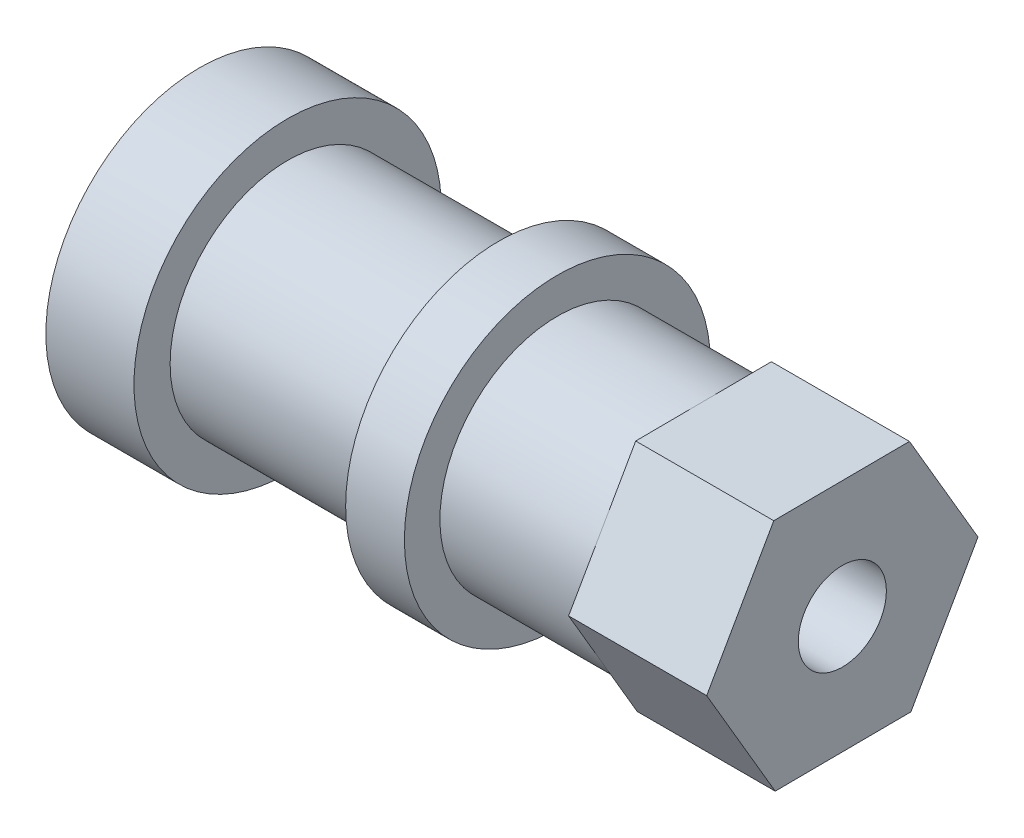
from build123d import *

# Parameters (mm, degrees)
BOSS_EXTRUDE1_DEPTH     = 4.7
SKETCH3_R               = 4
SKETCH3_R_2             = 1.5
BOSS_EXTRUDE2_DEPTH     = 17.185
SKETCH4_R               = 5.231012233
BOSS_EXTRUDE3_DEPTH     = 3
CUT_EXTRUDE1_DEPTH      = 24.101519495
CUT_EXTRUDE1_DEPTH_BACK = 24.101519495
SKETCH2_R               = 1.5
CUT_EXTRUDE4_DEPTH      = 2
BOSS_EXTRUDE5_START     = -7
SKETCH7_R               = 5.209530261
SKETCH7_R_2             = 1.5
BOSS_EXTRUDE5_DEPTH     = 2


with BuildPart() as part:
    # Sketch1 → Boss-Extrude1 (new body)
    with BuildSketch(Plane(origin=(0, 0, 0), x_dir=(0, 0, -1), z_dir=(1, 0, 0))):
        Polygon((-4.618711934, -0.028868683), (-2.284354955, -4.014356209), (2.33435698, -3.985487527), (4.618711934, 0.028868683), (2.284354955, 4.014356209), (-2.33435698, 3.985487527), align=None)
    extrude(amount=BOSS_EXTRUDE1_DEPTH)

    # Sketch3 → Boss-Extrude2 (add)
    with BuildSketch(Plane.ZY):
        with Locations(Location((0, 0, 0), (0, 0, 209.641884541))):
            Circle(SKETCH3_R)
        with Locations(Location((0, 0, 0), (0, 0, 180))):
            Circle(SKETCH3_R_2, mode=Mode.SUBTRACT)
    extrude(amount=BOSS_EXTRUDE2_DEPTH)

    # Sketch4 → Boss-Extrude3 (add)
    with BuildSketch(Plane.ZY.offset(17.185)):
        with Locations(Location((0, 0, 0), (0, 0, 270))):
            Circle(SKETCH4_R)
    extrude(amount=-BOSS_EXTRUDE3_DEPTH)

    # Sketch2 → Cut-Extrude1 (cut, two sides: drawn at the far end of the back side and taken through both)
    with BuildSketch(Plane(origin=(4.7, 0, 0), x_dir=(0, 0, -1), z_dir=(1, 0, 0)).offset(-CUT_EXTRUDE1_DEPTH_BACK)):
        Circle(SKETCH2_R)
    extrude(amount=CUT_EXTRUDE1_DEPTH + CUT_EXTRUDE1_DEPTH_BACK, mode=Mode.SUBTRACT)

    # Sketch6 → Cut-Extrude4 (cut)
    with BuildSketch(Plane.ZY.offset(17.185)):
        Polygon((0, -2.886751346), (2.5, -1.443375673), (2.5, 1.443375673), (0, 2.886751346), (-2.5, 1.443375673), (-2.5, -1.443375673), align=None)
    extrude(amount=-CUT_EXTRUDE4_DEPTH, mode=Mode.SUBTRACT)

    # Sketch7 → Boss-Extrude5 (add)
    with BuildSketch(Plane(origin=(0, 0, 0), x_dir=(0, 0, -1), z_dir=(1, 0, 0)).offset(BOSS_EXTRUDE5_START)):
        with Locations(Location((0, 0, 0), (0, 0, 180))):
            Circle(SKETCH7_R)
        Circle(SKETCH7_R_2, mode=Mode.SUBTRACT)
    extrude(amount=BOSS_EXTRUDE5_DEPTH)


solid = part.part
